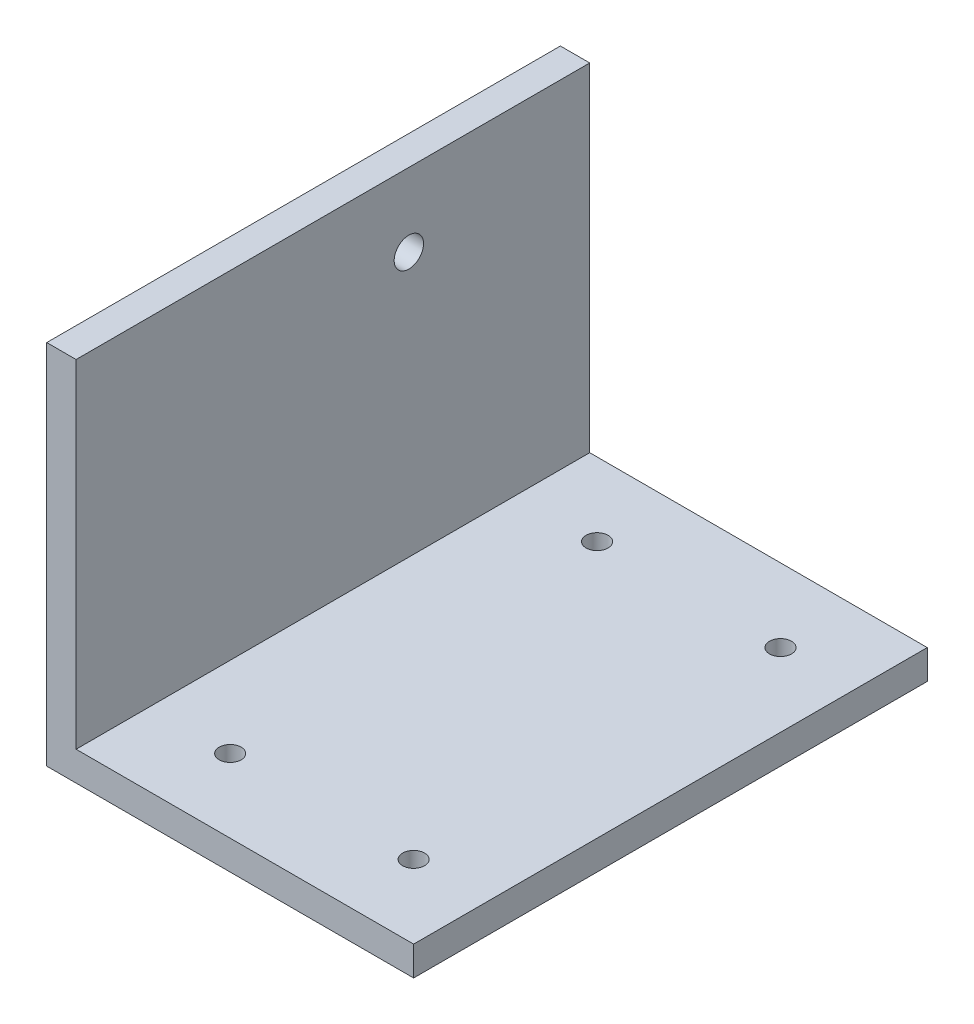
from build123d import *

# Parameters (mm, degrees)
EXTRUSION1_DEPTH                = 70
ESQUISSE2_R                     = 1.5
EXTRUSION2_DEPTH                = 98.549987186
R_P_TITION_LIN_AIRE1_COUNT      = 2
R_P_TITION_LIN_AIRE1_PITCH      = 50
R_P_TITION_LIN_AIRE1_COUNT_DIR2 = 2
R_P_TITION_LIN_AIRE1_PITCH_DIR2 = 25
ESQUISSE3_R                     = 2
ENL_V_MAT_EXTRU_1_DEPTH         = 10


with BuildPart() as part:
    # Esquisse1 → Extrusion1 (new body)
    with BuildSketch(Plane.XY):
        Polygon((0, 0), (4, 0), (50, 0), (50, 4), (4, 4), (4, 50), (0, 50), align=None)
    extrude(amount=EXTRUSION1_DEPTH)

    # Esquisse2 → Extrusion2 (cut, through all)
    with BuildSketch(Plane(origin=(0, 4, 0), x_dir=(1, 0, 0), z_dir=(0, 1, 0))):
        with Locations(Location((40, -60, 0), (0, 0, 270))):
            Circle(ESQUISSE2_R)
    extrusion2 = extrude(amount=-EXTRUSION2_DEPTH, mode=Mode.SUBTRACT)

    # Répétition linéaire1: Extrusion2 2 × 2
    with Locations(*[(-j * R_P_TITION_LIN_AIRE1_PITCH_DIR2, 0, -i * R_P_TITION_LIN_AIRE1_PITCH) for i in range(R_P_TITION_LIN_AIRE1_COUNT) for j in range(R_P_TITION_LIN_AIRE1_COUNT_DIR2) if (i, j) != (0, 0)]):
        add(extrusion2, mode=Mode.SUBTRACT)

    # Esquisse3 → Enlèv. mat.-Extru.1 (cut)
    with BuildSketch(Plane.ZY):
        with Locations((24.65, 40)):
            Circle(ESQUISSE3_R)
    extrude(amount=-ENL_V_MAT_EXTRU_1_DEPTH, mode=Mode.SUBTRACT)


solid = part.part
